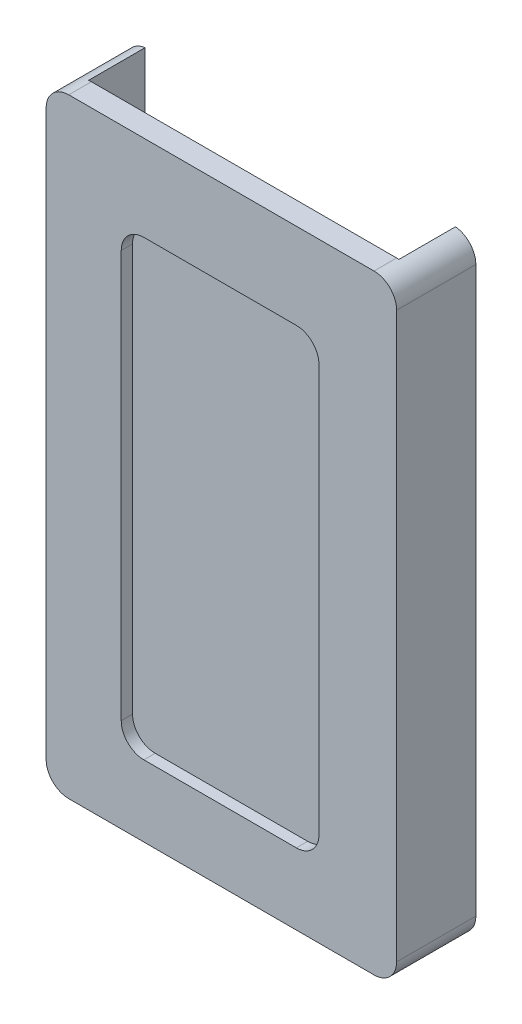
from build123d import *

# Parameters (mm, degrees)
SKETCH_5_W          = 30.974653289
SKETCH_5_H          = 53.868777402
SKETCH_5_W_2        = 27.381586342
SKETCH_5_H_2        = 50.41539456
EXTRUDE_3_DEPTH     = 5
SKETCH_6_W          = 27.427442828
SKETCH_6_H          = 5
CUT_EXTRUDE_4_DEPTH = 4
SKETCH_8_W          = 6.119989238
SKETCH_8_H          = 1.581115617
CUT_EXTRUDE_6_DEPTH = 3
SKETCH_9_W          = 30.974653289
SKETCH_9_H          = 53.868777402
EXTRUDE_5_DEPTH     = 2
SKETCH_10_W         = 17.475002228
SKETCH_10_H         = 39.986467982
CUT_EXTRUDE_7_DEPTH = 1
FILLET_1_R          = 2
FILLET_2_R          = 2


with BuildPart() as part:
    # 草图5 → 凸台-拉伸3 (new body)
    with BuildSketch(Plane.XY.offset(17)):
        with Locations((52.154033433, -51.822040042)):
            Rectangle(SKETCH_5_W, SKETCH_5_H)
        with Locations((52.104679946, -51.967615846)):
            Rectangle(SKETCH_5_W_2, SKETCH_5_H_2, mode=Mode.SUBTRACT)
    extrude(amount=EXTRUDE_3_DEPTH)

    # 草图6 → 切除-拉伸4 (cut)
    with BuildSketch(Plane(origin=(0, -24.887651341, 0), x_dir=(1, 0, 0), z_dir=(0, 1, 0))):
        with Locations((52.127608189, -19.5)):
            Rectangle(SKETCH_6_W, SKETCH_6_H)
    extrude(amount=-CUT_EXTRUDE_4_DEPTH, mode=Mode.SUBTRACT)

    # 草图8 → 切除-拉伸6 (cut)
    with BuildSketch(Plane(origin=(0, 0, 17), x_dir=(-1, 0, 0), z_dir=(0, 0, -1))):
        with Locations((-52.130085605, -77.965870935)):
            Rectangle(SKETCH_8_W, SKETCH_8_H)
    extrude(amount=-CUT_EXTRUDE_6_DEPTH, mode=Mode.SUBTRACT)

    # 草图9 → 凸台-拉伸5 (add)
    with BuildSketch(Plane.XY.offset(22)):
        with Locations((52.154033433, -51.822040042)):
            Rectangle(SKETCH_9_W, SKETCH_9_H)
    extrude(amount=EXTRUDE_5_DEPTH)

    # 草图10 → 切除-拉伸7 (cut)
    with BuildSketch(Plane.XY.offset(24)):
        with Locations((52.039568352, -52.470675496)):
            Rectangle(SKETCH_10_W, SKETCH_10_H)
    extrude(amount=-CUT_EXTRUDE_7_DEPTH, mode=Mode.SUBTRACT)

    # 圆角1
    fillet_1_edges = [part.edges().sort_by_distance(p)[0] for p in [
        (67.641360077, -78.756428743, 20.5),
        (36.666706788, -78.756428743, 20.5),
        (36.666706788, -24.887651341, 20.5),
        (67.641360077, -24.887651341, 20.5),
    ]]
    fillet(fillet_1_edges, radius=FILLET_1_R)

    # 圆角2
    fillet_2_edges = [part.edges().sort_by_distance(p)[0] for p in [
        (43.302067238, -72.463909487, 23.5),
        (43.302067238, -32.477441505, 23.5),
        (60.777069466, -32.477441505, 23.5),
        (60.777069466, -72.463909487, 23.5),
    ]]
    fillet(fillet_2_edges, radius=FILLET_2_R)


solid = part.part
